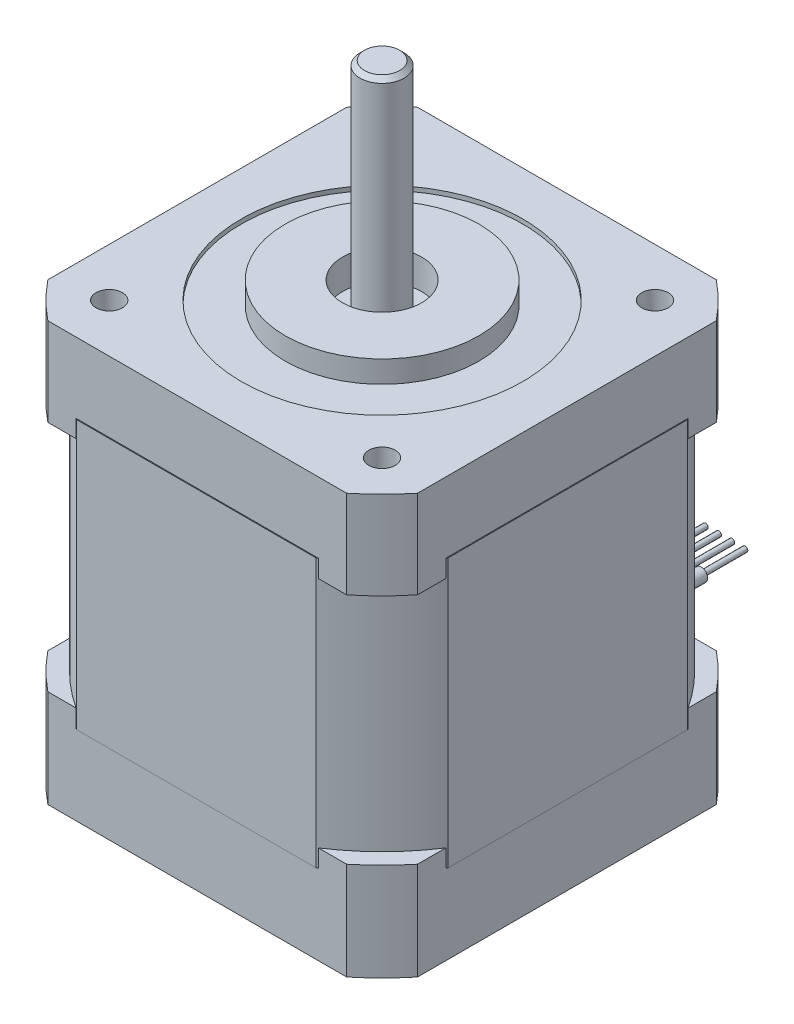
from build123d import *

# Parameters (mm, degrees)
SKETCH_2_R          = 1.5
EXTRUDE_2_DEPTH     = 8
SKETCH_3_R          = 16
CUT_EXTRUDE_1_DEPTH = 0.5
SKETCH_4_R          = 11
EXTRUDE_3_DEPTH     = 2.5
SKETCH_5_R          = 4.5
CUT_EXTRUDE_2_DEPTH = 3.4
SKETCH_6_R          = 2.5
EXTRUDE_4_DEPTH     = 25
CHAMFER_2_SIZE      = 0.5
EXTRUDE_START       = -2
SKETCH_2_2_R        = 1.5
EXTRUDE_5_DEPTH     = 2
EXTRUDE_START_2     = -30.5
SKETCH_7_R          = 1.5
EXTRUDE_6_DEPTH     = 30.5
SKETCH_8_R          = 1.5
EXTRUDE_8_DEPTH     = 2
EXTRUDE_START_3     = 9.1
SKETCH_8_3_R        = 1.5
EXTRUDE_9_DEPTH     = 9.1
SKETCH_9_R          = 3.5
SKETCH_9_R_2        = 3
CUT_EXTRUDE_3_DEPTH = 3.5
SKETCH_10_R         = 2.5
EXTRUDE_10_DEPTH    = 3
EXTRUDE_START_4     = -39
SKETCH_10_2_R       = 2.5
EXTRUDE_11_DEPTH    = 39
FILLET_2_R          = 2
FILLET_3_R          = 2
FILLET_4_R          = 2
FILLET_5_R          = 2
CUT_EXTRUDE_4_DEPTH = 3.5
CUT_EXTRUDE_5_DEPTH = 2
SKETCH_13_R         = 0.74
EXTRUDE_16_DEPTH    = 15
SKETCH_14_R         = 0.3
EXTRUDE_17_DEPTH    = 5


with BuildPart() as part:
    # 草图2 → 凸台-拉伸2 (new body)
    with BuildSketch(Plane(origin=(0, 0, 0), x_dir=(1, 0, 0), z_dir=(0, 1, 0))):
        with BuildLine():
            Line((16.970562748, 21), (-16.970562748, 21))
            ThreePointArc((-16.970562748, 21), (-19.091883092, 19.091883092), (-21, 16.970562748))
            Line((-21, 16.970562748), (-21, -16.970562748))
            ThreePointArc((-21, -16.970562748), (-19.091883092, -19.091883092), (-16.970562748, -21))
            Line((-16.970562748, -21), (16.970562748, -21))
            ThreePointArc((16.970562748, -21), (19.091883092, -19.091883092), (21, -16.970562748))
            Line((21, -16.970562748), (21, 16.970562748))
            ThreePointArc((21, 16.970562748), (19.091883092, 19.091883092), (16.970562748, 21))
        make_face()
        with Locations((-15.5, 15.5)):
            Circle(SKETCH_2_R, mode=Mode.SUBTRACT)
        with Locations((15.5, 15.5)):
            Circle(SKETCH_2_R, mode=Mode.SUBTRACT)
        with Locations((15.5, -15.5)):
            Circle(SKETCH_2_R, mode=Mode.SUBTRACT)
        with Locations((-15.5, -15.5)):
            Circle(SKETCH_2_R, mode=Mode.SUBTRACT)
    extrude(amount=EXTRUDE_2_DEPTH)

    # 草图3 → 切除-拉伸1 (cut)
    with BuildSketch(Plane(origin=(0, 8, 0), x_dir=(1, 0, 0), z_dir=(0, 1, 0))):
        Circle(SKETCH_3_R)
    extrude(amount=-CUT_EXTRUDE_1_DEPTH, mode=Mode.SUBTRACT)

    # 草图4 → 凸台-拉伸3 (add)
    with BuildSketch(Plane(origin=(0, 7.5, 0), x_dir=(1, 0, 0), z_dir=(0, 1, 0))):
        Circle(SKETCH_4_R)
    extrude(amount=EXTRUDE_3_DEPTH)

    # 草图5 → 切除-拉伸2 (cut)
    with BuildSketch(Plane(origin=(0, 10, 0), x_dir=(1, 0, 0), z_dir=(0, 1, 0))):
        Circle(SKETCH_5_R)
    extrude(amount=-CUT_EXTRUDE_2_DEPTH, mode=Mode.SUBTRACT)

    # 草图6 → 凸台-拉伸4 (add)
    with BuildSketch(Plane(origin=(0, 6.6, 0), x_dir=(1, 0, 0), z_dir=(0, 1, 0))):
        Circle(SKETCH_6_R)
    extrude(amount=EXTRUDE_4_DEPTH)

    # 倒角2
    chamfer_2_edges = [part.edges().sort_by_distance(p)[0] for p in [
        (-2.5, 31.6, 0),
    ]]
    chamfer(chamfer_2_edges, length=CHAMFER_2_SIZE)

    # 草图2<2> → 凸台-拉伸5 (add)
    with BuildSketch(Plane(origin=(0, 0, 0), x_dir=(1, 0, 0), z_dir=(0, 1, 0)).offset(EXTRUDE_START)):
        with BuildLine():
            Line((16.970562748, 21), (-16.970562748, 21))
            ThreePointArc((-16.970562748, 21), (-19.091883092, 19.091883092), (-21, 16.970562748))
            Line((-21, 16.970562748), (-21, -16.970562748))
            ThreePointArc((-21, -16.970562748), (-19.091883092, -19.091883092), (-16.970562748, -21))
            Line((-16.970562748, -21), (16.970562748, -21))
            ThreePointArc((16.970562748, -21), (19.091883092, -19.091883092), (21, -16.970562748))
            Line((21, -16.970562748), (21, 16.970562748))
            ThreePointArc((21, 16.970562748), (19.091883092, 19.091883092), (16.970562748, 21))
        make_face()
        with Locations((-15.5, 15.5)):
            Circle(SKETCH_2_2_R, mode=Mode.SUBTRACT)
        with Locations((15.5, 15.5)):
            Circle(SKETCH_2_2_R, mode=Mode.SUBTRACT)
        with Locations((15.5, -15.5)):
            Circle(SKETCH_2_2_R, mode=Mode.SUBTRACT)
        with Locations((-15.5, -15.5)):
            Circle(SKETCH_2_2_R, mode=Mode.SUBTRACT)
    extrude(amount=EXTRUDE_5_DEPTH)

    # 草图7 → 凸台-拉伸6 (add)
    with BuildSketch(Plane(origin=(0, 0, 0), x_dir=(1, 0, 0), z_dir=(0, 1, 0)).offset(EXTRUDE_START_2)):
        with BuildLine():
            Line((13.612571396, 21.1), (-13.612571396, 21.1))
            ThreePointArc((-13.612571396, 21.1), (-17.755451276, 17.755451276), (-21.1, 13.612571396))
            Line((-21.1, 13.612571396), (-21.1, -13.612571396))
            ThreePointArc((-21.1, -13.612571396), (-17.755451276, -17.755451276), (-13.612571396, -21.1))
            Line((-13.612571396, -21.1), (13.612571396, -21.1))
            ThreePointArc((13.612571396, -21.1), (17.755451276, -17.755451276), (21.1, -13.612571396))
            Line((21.1, -13.612571396), (21.1, 13.612571396))
            ThreePointArc((21.1, 13.612571396), (17.755451276, 17.755451276), (13.612571396, 21.1))
        make_face()
        with Locations((-15.5, 15.5)):
            Circle(SKETCH_7_R, mode=Mode.SUBTRACT)
        with Locations((15.5, 15.5)):
            Circle(SKETCH_7_R, mode=Mode.SUBTRACT)
        with Locations((-15.5, -15.5)):
            Circle(SKETCH_7_R, mode=Mode.SUBTRACT)
        with Locations((15.5, -15.5)):
            Circle(SKETCH_7_R, mode=Mode.SUBTRACT)
    extrude(amount=EXTRUDE_6_DEPTH)

    # 草图8 → 凸台-拉伸8 (add)
    with BuildSketch(Plane.XZ.offset(30.5)):
        with BuildLine():
            Line((16.970562748, 21), (-16.970562748, 21))
            ThreePointArc((-16.970562748, 21), (-19.091883092, 19.091883092), (-21, 16.970562748))
            Line((-21, 16.970562748), (-21, -16.970562748))
            ThreePointArc((-21, -16.970562748), (-19.091883092, -19.091883092), (-16.970562748, -21))
            Line((-16.970562748, -21), (16.970562748, -21))
            ThreePointArc((16.970562748, -21), (19.091883092, -19.091883092), (21, -16.970562748))
            Line((21, -16.970562748), (21, 16.970562748))
            ThreePointArc((21, 16.970562748), (19.091883092, 19.091883092), (16.970562748, 21))
        make_face()
        with Locations((-15.5, 15.5)):
            Circle(SKETCH_8_R, mode=Mode.SUBTRACT)
        with Locations((15.5, 15.5)):
            Circle(SKETCH_8_R, mode=Mode.SUBTRACT)
        with Locations((15.5, -15.5)):
            Circle(SKETCH_8_R, mode=Mode.SUBTRACT)
        with Locations((-15.5, -15.5)):
            Circle(SKETCH_8_R, mode=Mode.SUBTRACT)
    extrude(amount=-EXTRUDE_8_DEPTH)

    # 草图8<3> → 凸台-拉伸9 (add)
    with BuildSketch(Plane.XZ.offset(30.5).offset(EXTRUDE_START_3)):
        with BuildLine():
            Line((16.970562748, 21), (-16.970562748, 21))
            ThreePointArc((-16.970562748, 21), (-19.091883092, 19.091883092), (-21, 16.970562748))
            Line((-21, 16.970562748), (-21, -16.970562748))
            ThreePointArc((-21, -16.970562748), (-19.091883092, -19.091883092), (-16.970562748, -21))
            Line((-16.970562748, -21), (16.970562748, -21))
            ThreePointArc((16.970562748, -21), (19.091883092, -19.091883092), (21, -16.970562748))
            Line((21, -16.970562748), (21, 16.970562748))
            ThreePointArc((21, 16.970562748), (19.091883092, 19.091883092), (16.970562748, 21))
        make_face()
        with Locations((-15.5, 15.5)):
            Circle(SKETCH_8_3_R, mode=Mode.SUBTRACT)
        with Locations((15.5, 15.5)):
            Circle(SKETCH_8_3_R, mode=Mode.SUBTRACT)
        with Locations((15.5, -15.5)):
            Circle(SKETCH_8_3_R, mode=Mode.SUBTRACT)
        with Locations((-15.5, -15.5)):
            Circle(SKETCH_8_3_R, mode=Mode.SUBTRACT)
    extrude(amount=-EXTRUDE_9_DEPTH)

    # 草图9 → 切除-拉伸3 (cut)
    with BuildSketch(Plane.XZ.offset(39.6)):
        Circle(SKETCH_9_R)
        with Locations((-15.5, 15.5)):
            Circle(SKETCH_9_R_2)
        with Locations((15.5, 15.5)):
            Circle(SKETCH_9_R_2)
        with Locations((-15.5, -15.5)):
            Circle(SKETCH_9_R_2)
        with Locations((15.5, -15.5)):
            Circle(SKETCH_9_R_2)
    extrude(amount=-CUT_EXTRUDE_3_DEPTH, mode=Mode.SUBTRACT)

    # 草图10 → 凸台-拉伸10 (add)
    with BuildSketch(Plane.XZ.offset(36.1)):
        with Locations((15.5, -15.5)):
            Circle(SKETCH_10_R)
        with Locations((15.5, 15.5)):
            Circle(SKETCH_10_R)
        with Locations((-15.5, 15.5)):
            Circle(SKETCH_10_R)
        with Locations((-15.5, -15.5)):
            Circle(SKETCH_10_R)
    extrude(amount=EXTRUDE_10_DEPTH)

    # 草图10<2> → 凸台-拉伸11 (add)
    with BuildSketch(Plane.XZ.offset(36.1).offset(EXTRUDE_START_4)):
        with Locations((15.5, -15.5)):
            Circle(SKETCH_10_2_R)
        with Locations((15.5, 15.5)):
            Circle(SKETCH_10_2_R)
        with Locations((-15.5, 15.5)):
            Circle(SKETCH_10_2_R)
        with Locations((-15.5, -15.5)):
            Circle(SKETCH_10_2_R)
    extrude(amount=EXTRUDE_11_DEPTH)

    # 圆角2
    fillet_2_edges = [part.edges().sort_by_distance(p)[0] for p in [
        (-18, -39.1, -15.5),
    ]]
    fillet(fillet_2_edges, radius=FILLET_2_R)

    # 圆角3
    fillet_3_edges = [part.edges().sort_by_distance(p)[0] for p in [
        (13, -39.1, -15.5),
    ]]
    fillet(fillet_3_edges, radius=FILLET_3_R)

    # 圆角4
    fillet_4_edges = [part.edges().sort_by_distance(p)[0] for p in [
        (13, -39.1, 15.5),
    ]]
    fillet(fillet_4_edges, radius=FILLET_4_R)

    # 圆角5
    fillet_5_edges = [part.edges().sort_by_distance(p)[0] for p in [
        (-18, -39.1, 15.5),
    ]]
    fillet(fillet_5_edges, radius=FILLET_5_R)

    # 草图11 → 切除-拉伸4 (cut)
    with BuildSketch(Plane.XZ.offset(39.6)):
        Polygon((-15.5, 17.1), (-15.2, 17.1), (-15.2, 15.8), (-13.9, 15.8), (-13.9, 15.2), (-15.2, 15.2), (-15.2, 13.9), (-15.8, 13.9), (-15.8, 15.2), (-17.1, 15.2), (-17.1, 15.8), (-15.8, 15.8), (-15.8, 17.1), align=None)
        Polygon((15.8, 17.1), (15.5, 17.1), (15.2, 17.1), (15.2, 15.8), (13.9, 15.8), (13.9, 15.2), (15.2, 15.2), (15.2, 13.9), (15.8, 13.9), (15.8, 15.2), (17.1, 15.2), (17.1, 15.8), (15.8, 15.8), align=None)
        Polygon((15.5, -17.1), (15.2, -17.1), (15.2, -15.8), (13.9, -15.8), (13.9, -15.2), (15.2, -15.2), (15.2, -13.9), (15.8, -13.9), (15.8, -15.2), (17.1, -15.2), (17.1, -15.8), (15.8, -15.8), (15.8, -17.1), align=None)
        Polygon((-15.8, -17.1), (-15.5, -17.1), (-15.2, -17.1), (-15.2, -15.8), (-13.9, -15.8), (-13.9, -15.2), (-15.2, -15.2), (-15.2, -13.9), (-15.8, -13.9), (-15.8, -15.2), (-17.1, -15.2), (-17.1, -15.8), (-15.8, -15.8), align=None)
    extrude(amount=-CUT_EXTRUDE_4_DEPTH, mode=Mode.SUBTRACT)

    # 草图12 → 切除-拉伸5 (cut)
    with BuildSketch(Plane(origin=(0, 0, -21), x_dir=(-1, 0, 0), z_dir=(0, 0, -1))):
        Polygon((0, -35.6), (3, -35.6), (3, -34.1), (-3, -34.1), (-3, -35.6), align=None)
    extrude(amount=-CUT_EXTRUDE_5_DEPTH, mode=Mode.SUBTRACT)

    # 草图13 → 凸台-拉伸16 (add)
    with BuildSketch(Plane(origin=(0, 0, -19), x_dir=(-1, 0, 0), z_dir=(0, 0, -1))):
        with Locations((-0.75, -34.85)):
            Circle(SKETCH_13_R)
        with Locations((-2.25, -34.85)):
            Circle(SKETCH_13_R)
        with Locations((0.75, -34.85)):
            Circle(SKETCH_13_R)
        with Locations((2.25, -34.85)):
            Circle(SKETCH_13_R)
    extrude(amount=EXTRUDE_16_DEPTH)

    # 草图14 → 凸台-拉伸17 (add)
    with BuildSketch(Plane(origin=(0, 0, -34), x_dir=(-1, 0, 0), z_dir=(0, 0, -1))):
        with Locations((-2.25, -34.85)):
            Circle(SKETCH_14_R)
        with Locations((-0.75, -34.85)):
            Circle(SKETCH_14_R)
        with Locations((0.75, -34.85)):
            Circle(SKETCH_14_R)
        with Locations((2.25, -34.85)):
            Circle(SKETCH_14_R)
    extrude(amount=EXTRUDE_17_DEPTH)


solid = part.part
